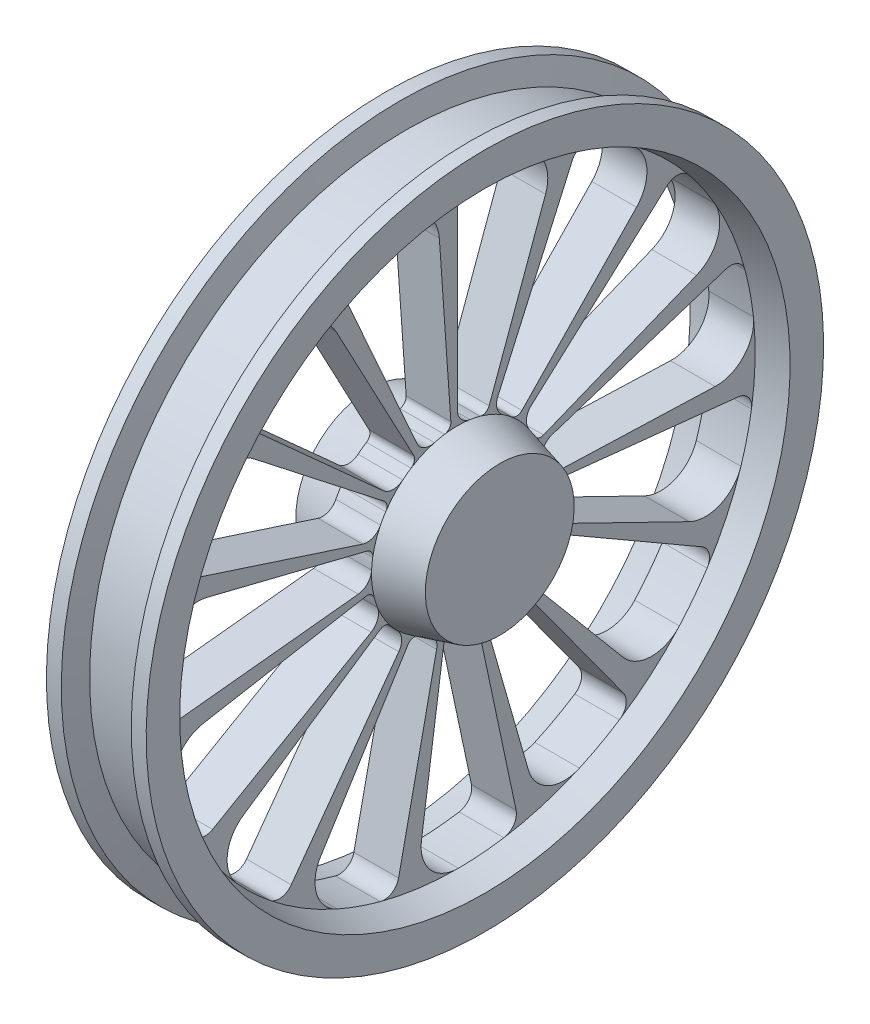
from build123d import *

# Parameters (mm, degrees)
CUT_EXTRUDE1_DEPTH = 655.017583861
CIRPATTERN1_COUNT  = 15


with BuildPart() as part:
    # Sketch1 → Revolve1 (revolve)
    with BuildSketch(Plane.XY):
        Polygon((0, 0), (-87, 0), (-87, 100), (-30, 115.273103969), (-30, 400.08587988), (-67, 410), (-67, 455), (-47, 455), (-38.961524227, 425), (0, 425), align=None)
    revolve1 = revolve(axis=Axis((0, 0, 0), (-1, 0, 0)))

    # Mirror1: Revolve1 across plane
    add(revolve1.mirror(Plane(origin=(0, 425, 0), x_dir=(0, 0, 1), z_dir=(1, 0, 0))))

    # Sketch2 → Cut-Extrude1 (cut, symmetric)
    with BuildSketch(Plane(origin=(30, 0, 0), x_dir=(0, 0, -1), z_dir=(1, 0, 0))):
        with BuildLine():
            Line((0, 133.786444221), (0, 379.559318268))
            ThreePointArc((0, 379.559318268), (6.234969574, 394.06876131), (21.052393738, 399.531610761))
            ThreePointArc((21.052393738, 399.531610761), (51.546947015, 396.751337153), (81.739549487, 391.646980493))
            ThreePointArc((81.739549487, 391.646980493), (115.210537092, 367.022648586), (118.508930051, 325.60060932))
            Line((118.508930051, 325.60060932), (42.709197008, 117.342554382))
            ThreePointArc((42.709197008, 117.342554382), (37.897102193, 111.875724753), (30.653098979, 111.122797038))
            ThreePointArc((30.653098979, 111.122797038), (23.891598648, 112.770031536), (17.043018987, 114.006245453))
            ThreePointArc((17.043018987, 114.006245453), (4.84843869, 120.731552805), (0, 133.786444221))
        make_face()
    cut_extrude1 = extrude(amount=CUT_EXTRUDE1_DEPTH, both=True, mode=Mode.SUBTRACT)

    # CirPattern1: Cut-Extrude1 ×15 about axis
    cirpattern1_axis = Axis((0, 0, 0), (1, 0, 0))
    for i in range(1, CIRPATTERN1_COUNT):
        add(cut_extrude1.rotate(cirpattern1_axis, i * 360 / CIRPATTERN1_COUNT), mode=Mode.SUBTRACT)


solid = part.part
